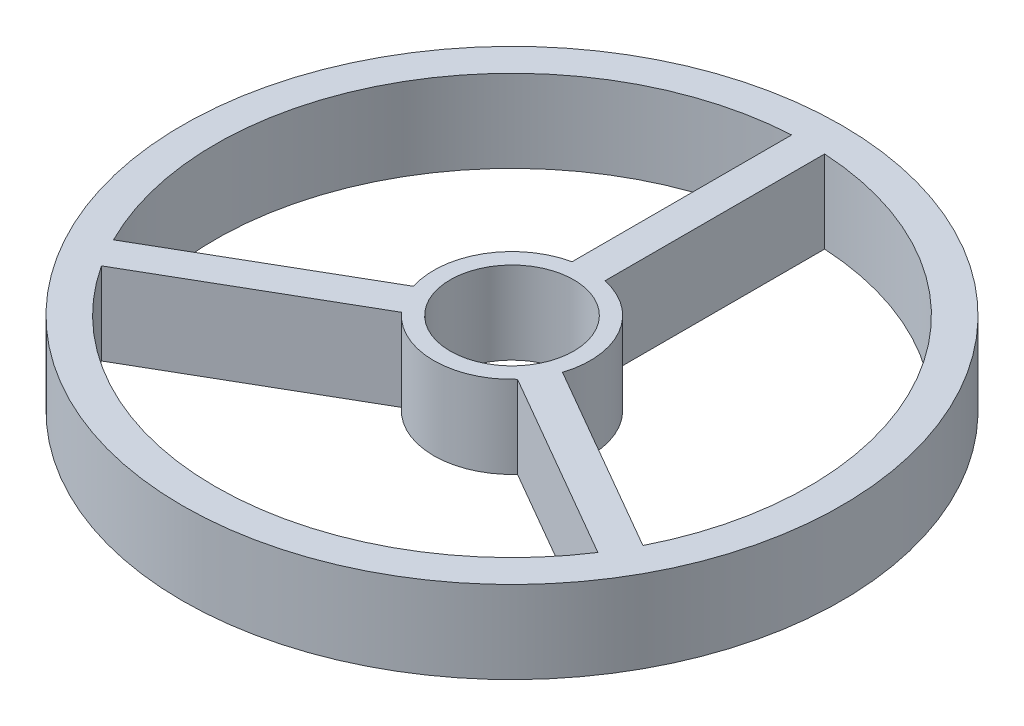
from build123d import *

# Parameters (mm, degrees)
SKETCH2_R           = 40
SKETCH2_R_2         = 7.5
BOSS_EXTRUDE1_DEPTH = 5


with BuildPart() as part:
    # Sketch2 → Boss-Extrude1 (new, symmetric)
    with BuildSketch(Plane(origin=(0, 0, 0), x_dir=(1, 0, 0), z_dir=(0, 1, 0))):
        with Locations(Location((0, 0, 0), (0, 0, 270))):
            Circle(SKETCH2_R)
        with Locations(Location((0, 0, 0), (0, 0, 270))):
            Circle(SKETCH2_R_2, mode=Mode.SUBTRACT)
        with BuildLine():
            Line((-2, 35.944401511), (-2, 9.287087811))
            ThreePointArc((-2, 9.287087811), (-8.227241336, 4.75), (-9.042853971, -2.911493098))
            Line((-9.042853971, -2.911493098), (-32.128764833, -16.240149948))
            ThreePointArc((-32.128764833, -16.240149948), (-31.176914536, 18), (-2, 35.944401511))
        make_face(mode=Mode.SUBTRACT)
        with BuildLine():
            Line((2, 35.944401511), (2, 9.287087811))
            ThreePointArc((2, 9.287087811), (8.227241336, 4.75), (9.042853971, -2.911493098))
            Line((9.042853971, -2.911493098), (32.128764833, -16.240149948))
            ThreePointArc((32.128764833, -16.240149948), (31.176914536, 18), (2, 35.944401511))
        make_face(mode=Mode.SUBTRACT)
        with BuildLine():
            Line((-7.042853971, -6.375594713), (-30.128764833, -19.704251563))
            ThreePointArc((-30.128764833, -19.704251563), (0, -36), (30.128764833, -19.704251563))
            Line((30.128764833, -19.704251563), (7.042853971, -6.375594713))
            ThreePointArc((7.042853971, -6.375594713), (0, -9.5), (-7.042853971, -6.375594713))
        make_face(mode=Mode.SUBTRACT)
    extrude(amount=BOSS_EXTRUDE1_DEPTH, both=True)


solid = part.part
